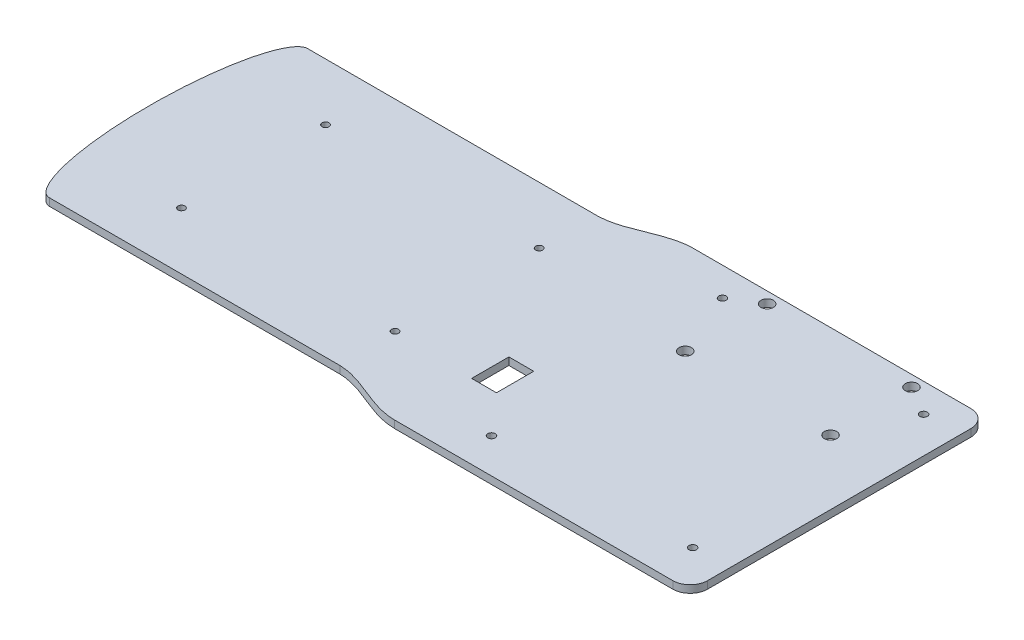
from build123d import *

# Parameters (mm, degrees)
SKETCH_1_W           = 278
SKETCH_1_H           = 120
EXTRUDE_1_DEPTH      = 3
SKETCH_2_W           = 129
SKETCH_2_H           = 8
CUT_EXTRUDE_1_DEPTH  = 3
CUT_EXTRUDE_2_DEPTH  = 3
CUT_EXTRUDE_4_DEPTH  = 3
CUT_EXTRUDE_5_DEPTH  = 3
SKETCH_16_R          = 1.39979
CUT_EXTRUDE_9_DEPTH  = 10
SKETCH_18_W          = 10
SKETCH_18_H          = 15
CUT_EXTRUDE_10_DEPTH = 10
SKETCH_19_R          = 2.5
CUT_EXTRUDE_11_DEPTH = 10
SKETCH_20_R          = 1.5
CUT_EXTRUDE_12_DEPTH = 10
SKETCH_21_R          = 1.5
CUT_EXTRUDE_13_DEPTH = 10
SKETCH_22_R          = 2.5
CUT_EXTRUDE_14_DEPTH = 10
SKETCH_23_R          = 2.5
CUT_EXTRUDE_15_DEPTH = 10
SKETCH_24_R          = 1.5
CUT_EXTRUDE_16_DEPTH = 10
SKETCH_25_R          = 1.5
CUT_EXTRUDE_17_DEPTH = 10


with BuildPart() as part:
    # 스케치1 → 보스-돌출1 (new body)
    with BuildSketch(Plane(origin=(0, 0, 0), x_dir=(1, 0, 0), z_dir=(0, 1, 0))):
        Rectangle(SKETCH_1_W, SKETCH_1_H)
    extrude(amount=EXTRUDE_1_DEPTH)

    # 스케치2 → 컷-돌출1 (cut)
    with BuildSketch(Plane(origin=(0, 3, 0), x_dir=(1, 0, 0), z_dir=(0, 1, 0))):
        with Locations((-74.5, -56)):
            Rectangle(SKETCH_2_W, SKETCH_2_H)
        with Locations((-74.5, 56)):
            Rectangle(SKETCH_2_W, SKETCH_2_H)
    extrude(amount=-CUT_EXTRUDE_1_DEPTH, mode=Mode.SUBTRACT)

    # 스케치3 → 컷-돌출2 (cut)
    with BuildSketch(Plane(origin=(0, 3, 0), x_dir=(1, 0, 0), z_dir=(0, 1, 0))):
        with BuildLine():
            add(Edge.make_bspline(
                [(-127, 52), (-139, 52), (-139, 0)],
                knots=[3.141592654, 3.141592654, 3.141592654, 4.71238898, 4.71238898, 4.71238898], degree=2, weights=[1, 0.707106781, 1]))
            Line((-127, 52), (-139, 52))
            Line((-139, 52), (-139, 0))
        make_face()
        with BuildLine():
            Line((-139, -52), (-127, -52))
            add(Edge.make_bspline(
                [(-139, 0), (-139, -52), (-127, -52)],
                knots=[4.71238898, 4.71238898, 4.71238898, 6.283185307, 6.283185307, 6.283185307], degree=2, weights=[1, 0.707106781, 1]))
            Line((-139, 0), (-139, -52))
        make_face()
    extrude(amount=-CUT_EXTRUDE_2_DEPTH, mode=Mode.SUBTRACT)

    # 스케치4 → 컷-돌출4 (cut)
    with BuildSketch(Plane(origin=(0, 3, 0), x_dir=(1, 0, 0), z_dir=(0, 1, 0))):
        with BuildLine():
            Line((-10, 52), (-10, 60))
            Line((-10, 60), (20, 60))
            add(Edge.make_bspline(
                [(-10, 52), (0.64121866, 52.367223255), (9.376693721, 59.919927591), (20, 60)],
                knots=[0, 0, 0, 0, 1, 1, 1, 1], degree=3))
        make_face()
        with BuildLine():
            Line((-10, -52), (-10, -60))
            Line((-10, -60), (20, -60))
            add(Edge.make_bspline(
                [(-10, -52), (0.64121866, -52.367223255), (9.376693721, -59.919927591), (20, -60)],
                knots=[0, 0, 0, 0, 1, 1, 1, 1], degree=3))
        make_face()
    extrude(amount=-CUT_EXTRUDE_4_DEPTH, mode=Mode.SUBTRACT)

    # 스케치5 → 컷-돌출5 (cut)
    with BuildSketch(Plane(origin=(0, 3, 0), x_dir=(1, 0, 0), z_dir=(0, 1, 0))):
        with BuildLine():
            Line((132, 60), (139, 60))
            Line((139, 60), (139, 53))
            ThreePointArc((139, 53), (136.949747468, 57.949747468), (132, 60))
        make_face()
        with BuildLine():
            Line((139, -60), (139, -53))
            ThreePointArc((139, -53), (136.949747468, -57.949747468), (132, -60))
            Line((132, -60), (139, -60))
        make_face()
    extrude(amount=-CUT_EXTRUDE_5_DEPTH, mode=Mode.SUBTRACT)

    # 스케치16 → 컷-돌출9 (cut)
    with BuildSketch(Plane(origin=(0, 3, 0), x_dir=(1, 0, 0), z_dir=(0, 1, 0))):
        with Locations(Location((-96.85129, 29.0311, 0), (0, 0, 270))):
            Circle(SKETCH_16_R)
        with Locations(Location((-96.85109, -28.96802, 0), (0, 0, 270))):
            Circle(SKETCH_16_R)
        with Locations(Location((-10.85223, 29.03265, 0), (0, 0, 270))):
            Circle(SKETCH_16_R)
        with Locations(Location((-10.8511, -28.96784, 0), (0, 0, 270))):
            Circle(SKETCH_16_R)
    extrude(amount=-CUT_EXTRUDE_9_DEPTH, mode=Mode.SUBTRACT)

    # 스케치18 → 컷-돌출10 (cut)
    with BuildSketch(Plane(origin=(0, 3, 0), x_dir=(1, 0, 0), z_dir=(0, 1, 0))):
        with Locations((26, -22.5)):
            Rectangle(SKETCH_18_W, SKETCH_18_H)
    extrude(amount=-CUT_EXTRUDE_10_DEPTH, mode=Mode.SUBTRACT)

    # 스케치19 → 컷-돌출11 (cut)
    with BuildSketch(Plane(origin=(0, 3, 0), x_dir=(1, 0, 0), z_dir=(0, 1, 0))):
        with Locations(Location((112.6, 55.5, 0), (0, 0, 270))):
            Circle(SKETCH_19_R)
    extrude(amount=-CUT_EXTRUDE_11_DEPTH, mode=Mode.SUBTRACT)

    # 스케치20 → 컷-돌출12 (cut)
    with BuildSketch(Plane(origin=(0, 3, 0), x_dir=(1, 0, 0), z_dir=(0, 1, 0))):
        with Locations(Location((124.5, 48.5, 0), (0, 0, 270))):
            Circle(SKETCH_20_R)
    extrude(amount=-CUT_EXTRUDE_12_DEPTH, mode=Mode.SUBTRACT)

    # 스케치21 → 컷-돌출13 (cut)
    with BuildSketch(Plane(origin=(0, 3, 0), x_dir=(1, 0, 0), z_dir=(0, 1, 0))):
        with Locations(Location((124.5, -44.5, 0), (0, 0, 270))):
            Circle(SKETCH_21_R)
    extrude(amount=-CUT_EXTRUDE_13_DEPTH, mode=Mode.SUBTRACT)

    # 스케치22 → 컷-돌출14 (cut)
    with BuildSketch(Plane(origin=(0, 3, 0), x_dir=(1, 0, 0), z_dir=(0, 1, 0))):
        with Locations(Location((54.5, 55.5, 0), (0, 0, 270))):
            Circle(SKETCH_22_R)
    extrude(amount=-CUT_EXTRUDE_14_DEPTH, mode=Mode.SUBTRACT)

    # 스케치23 → 컷-돌출15 (cut)
    with BuildSketch(Plane(origin=(0, 3, 0), x_dir=(1, 0, 0), z_dir=(0, 1, 0))):
        with Locations(Location((113, 22.5, 0), (0, 0, 270))):
            Circle(SKETCH_23_R)
        with Locations(Location((54.5, 22.5, 0), (0, 0, 270))):
            Circle(SKETCH_23_R)
    extrude(amount=-CUT_EXTRUDE_15_DEPTH, mode=Mode.SUBTRACT)

    # 스케치24 → 컷-돌출16 (cut)
    with BuildSketch(Plane(origin=(0, 3, 0), x_dir=(1, 0, 0), z_dir=(0, 1, 0))):
        with Locations(Location((45, -46, 0), (0, 0, 270))):
            Circle(SKETCH_24_R)
    extrude(amount=-CUT_EXTRUDE_16_DEPTH, mode=Mode.SUBTRACT)

    # 스케치25 → 컷-돌출17 (cut)
    with BuildSketch(Plane(origin=(0, 3, 0), x_dir=(1, 0, 0), z_dir=(0, 1, 0))):
        with Locations(Location((43.5, 48.5, 0), (0, 0, 270))):
            Circle(SKETCH_25_R)
    extrude(amount=-CUT_EXTRUDE_17_DEPTH, mode=Mode.SUBTRACT)


solid = part.part
